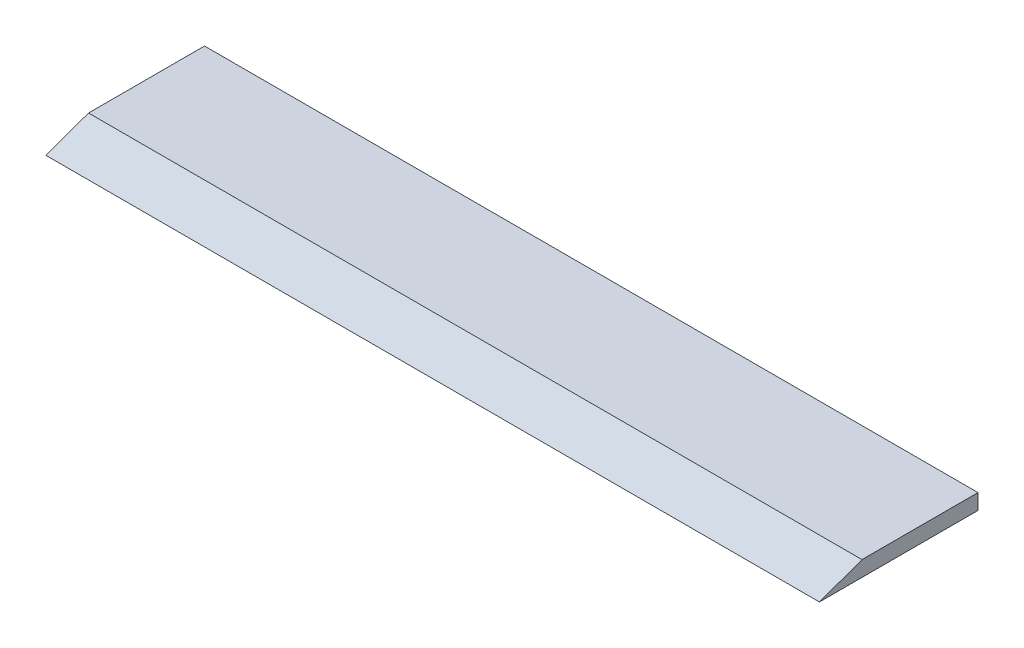
from build123d import *

# Parameters (mm, degrees)
SALIENTE_EXTRUIR1_DEPTH = 200


with BuildPart() as part:
    # Croquis1 → Saliente-Extruir1 (new body)
    with BuildSketch(Plane(origin=(0, 0, 0), x_dir=(0, 0, -1), z_dir=(1, 0, 0))):
        Polygon((0, 0), (10.989909678, 4), (40.989909678, 4), (40.989909678, 0), align=None)
    extrude(amount=SALIENTE_EXTRUIR1_DEPTH)


solid = part.part
